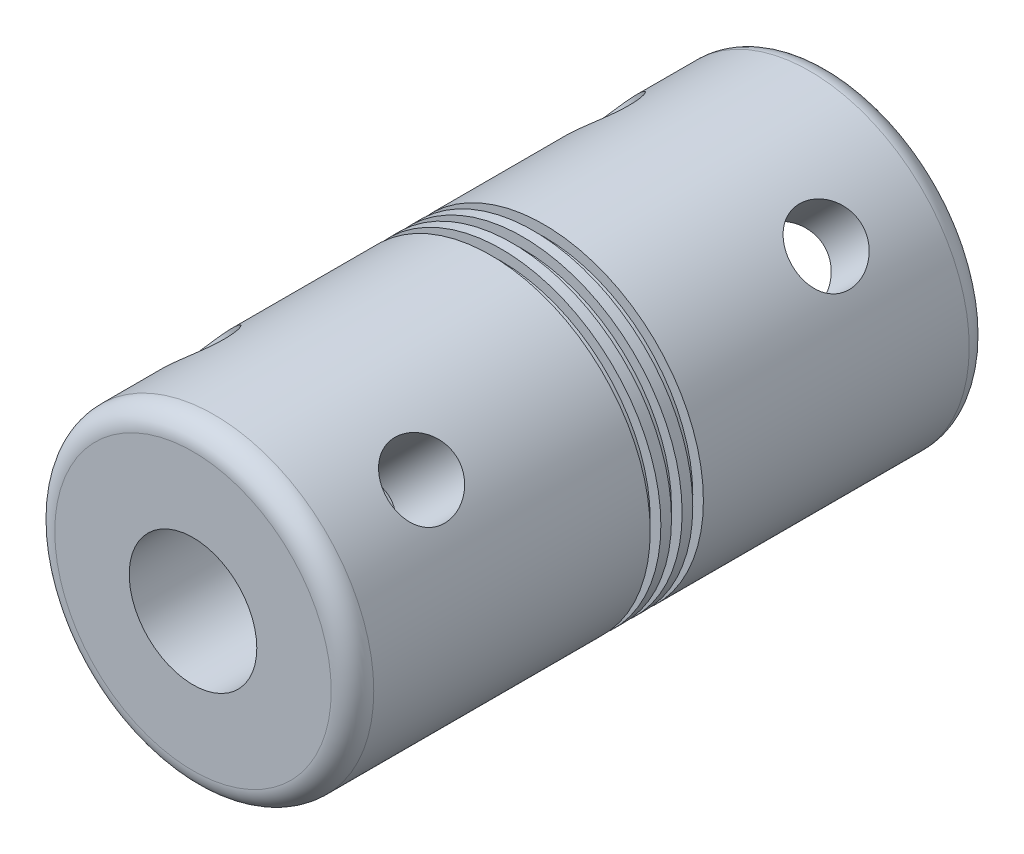
from build123d import *

# Parameters (mm, degrees)
SKETCH2_R           = 7.5
BOSS_EXTRUDE1_DEPTH = 15
SKETCH3_R           = 3
CUT_EXTRUDE1_DEPTH  = 15
SKETCH4_R           = 5
CUT_EXTRUDE2_DEPTH  = 15
SKETCH5_R           = 7.5
SKETCH5_R_2         = 7
CUT_EXTRUDE3_DEPTH  = 0.5
LPATTERN1_COUNT     = 2
LPATTERN1_PITCH     = 1
LPATTERN2_COUNT     = 2
LPATTERN2_PITCH     = 1
FILLET1_R           = 1


with BuildPart() as part:
    # Sketch2 → Boss-Extrude1 (new, symmetric)
    with BuildSketch(Plane.XY):
        Circle(SKETCH2_R)
    extrude(amount=BOSS_EXTRUDE1_DEPTH, both=True)

    # Sketch3 → Cut-Extrude1 (cut)
    with BuildSketch(Plane.XY.offset(15)):
        Circle(SKETCH3_R)
    extrude(amount=-CUT_EXTRUDE1_DEPTH, mode=Mode.SUBTRACT)

    # Sketch4 → Cut-Extrude2 (cut)
    with BuildSketch(Plane(origin=(0, 0, -15), x_dir=(-1, 0, 0), z_dir=(0, 0, -1))):
        Circle(SKETCH4_R)
    extrude(amount=-CUT_EXTRUDE2_DEPTH, mode=Mode.SUBTRACT)

    # Sketch5 → Cut-Extrude3 (cut)
    with BuildSketch(Plane.XY):
        Circle(SKETCH5_R)
        Circle(SKETCH5_R_2, mode=Mode.SUBTRACT)
    cut_extrude3 = extrude(amount=-CUT_EXTRUDE3_DEPTH, mode=Mode.SUBTRACT)

    # LPattern1: Cut-Extrude3 ×2
    with Locations(*[(0, 0, -i * LPATTERN1_PITCH) for i in range(1, LPATTERN1_COUNT)]):
        add(cut_extrude3, mode=Mode.SUBTRACT)

    # LPattern2: Cut-Extrude3 ×2
    with Locations(*[(0, 0, i * LPATTERN2_PITCH) for i in range(1, LPATTERN2_COUNT)]):
        add(cut_extrude3, mode=Mode.SUBTRACT)

    # Sketch9 → M4 Tapped Hole1 (revolve, cut)
    with BuildSketch(Plane(origin=(-5.303300859, 5.303300859, -9.511136026), x_dir=(-0.7071067811865488, -0.7071067811865464, 0), z_dir=(0, 0, 1))):
        Polygon((0, 0), (0, 6.991420021), (1.65, 6), (1.65, 0), align=None)
    m4_tapped_hole1 = revolve(axis=Axis((-9.793428919, 9.793428919, -9.511136026), (0.7071067811865465, -0.7071067811865487, 0)), mode=Mode.SUBTRACT)

    # Mirror1: M4 Tapped Hole1 across plane
    add(m4_tapped_hole1.mirror(Plane(origin=(0, 0, 0), x_dir=(0, 0, 1), z_dir=(1, 0, 0))), mode=Mode.SUBTRACT)

    # Mirror2: M4 Tapped Hole1 across plane
    add(m4_tapped_hole1.mirror(Plane.XY), mode=Mode.SUBTRACT)

    # Mirror2 copy 1 sketch → Mirror2 copy 1 (revolve, cut)
    with BuildSketch(Plane(origin=(5.303300859, 5.303300859, 9.511136026), x_dir=(0.7071067811865488, -0.7071067811865464, 0), z_dir=(0, 0, -1))):
        Polygon((0, 0), (0, 6.991420021), (1.65, 6), (1.65, 0), align=None)
    revolve(axis=Axis((9.793428919, 9.793428919, 9.511136026), (-0.7071067811865465, -0.7071067811865487, 0)), mode=Mode.SUBTRACT)

    # Fillet1
    fillet1_edges = [part.edges().sort_by_distance(p)[0] for p in [
        (-7.5, 0, -15),
        (-7.5, 0, 15),
    ]]
    fillet(fillet1_edges, radius=FILLET1_R)


solid = part.part
